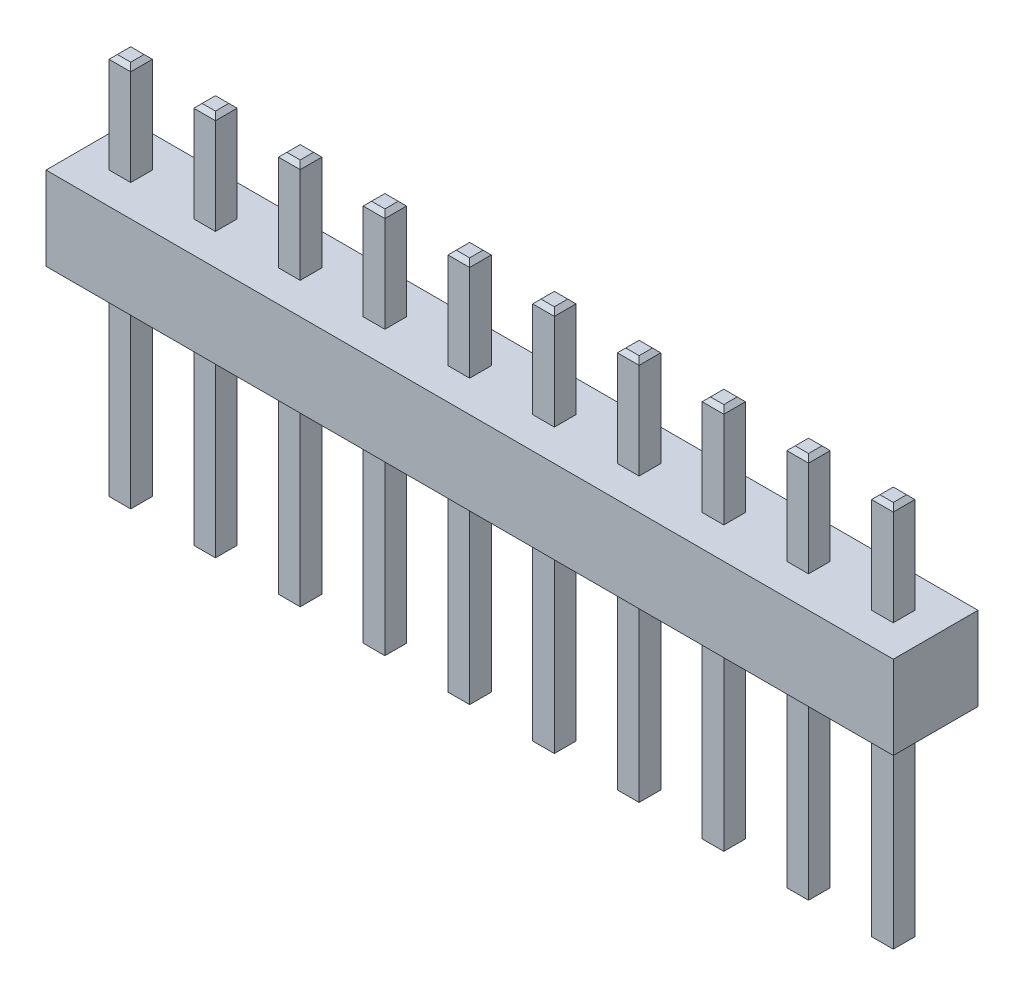
from build123d import *

# Parameters (mm, degrees)
SKETCH3_W           = 25.4
SKETCH3_H           = 2.54
BOSS_EXTRUDE1_DEPTH = 2.5
SKETCH4_W           = 0.65
SKETCH4_H           = 0.65
BOSS_EXTRUDE2_DEPTH = 3
SKETCH5_W           = 0.65
SKETCH5_H           = 0.65
BOSS_EXTRUDE3_DEPTH = 6.1
CHAMFER1_SIZE       = 0.125


with BuildPart() as part:
    # Sketch3 → Boss-Extrude1 (new body)
    with BuildSketch(Plane(origin=(0, 0, 0), x_dir=(1, 0, 0), z_dir=(0, 1, 0))):
        Rectangle(SKETCH3_W, SKETCH3_H)
    extrude(amount=BOSS_EXTRUDE1_DEPTH)

    # Sketch4 → Boss-Extrude2 (add)
    with BuildSketch(Plane(origin=(0, 2.5, 0), x_dir=(1, 0, 0), z_dir=(0, 1, 0))):
        with Locations((1.27, 0)):
            Rectangle(SKETCH4_W, SKETCH4_H)
        with Locations((3.81, 0)):
            Rectangle(SKETCH4_W, SKETCH4_H)
        with Locations((6.35, 0)):
            Rectangle(SKETCH4_W, SKETCH4_H)
        with Locations((8.89, 0)):
            Rectangle(SKETCH4_W, SKETCH4_H)
        with Locations((11.43, 0)):
            Rectangle(SKETCH4_W, SKETCH4_H)
        with Locations((-3.81, 0)):
            Rectangle(SKETCH4_W, SKETCH4_H)
        with Locations((-6.35, 0)):
            Rectangle(SKETCH4_W, SKETCH4_H)
        with Locations((-1.27, 0)):
            Rectangle(SKETCH4_W, SKETCH4_H)
        with Locations((-8.89, 0)):
            Rectangle(SKETCH4_W, SKETCH4_H)
        with Locations((-11.43, 0)):
            Rectangle(SKETCH4_W, SKETCH4_H)
    extrude(amount=BOSS_EXTRUDE2_DEPTH)

    # Sketch5 → Boss-Extrude3 (add)
    with BuildSketch(Plane.XZ):
        with Locations((1.27, 0)):
            Rectangle(SKETCH5_W, SKETCH5_H)
        with Locations((3.81, 0)):
            Rectangle(SKETCH5_W, SKETCH5_H)
        with Locations((6.35, 0)):
            Rectangle(SKETCH5_W, SKETCH5_H)
        with Locations((8.89, 0)):
            Rectangle(SKETCH5_W, SKETCH5_H)
        with Locations((11.43, 0)):
            Rectangle(SKETCH5_W, SKETCH5_H)
        with Locations((-3.81, 0)):
            Rectangle(SKETCH5_W, SKETCH5_H)
        with Locations((-6.35, 0)):
            Rectangle(SKETCH5_W, SKETCH5_H)
        with Locations((-1.27, 0)):
            Rectangle(SKETCH5_W, SKETCH5_H)
        with Locations((-8.89, 0)):
            Rectangle(SKETCH5_W, SKETCH5_H)
        with Locations((-11.43, 0)):
            Rectangle(SKETCH5_W, SKETCH5_H)
    extrude(amount=BOSS_EXTRUDE3_DEPTH)

    # Chamfer1
    chamfer1_edges = [part.edges().sort_by_distance(p)[0] for p in [
        (-8.565, 5.5, 0),
        (-8.89, 5.5, -0.325),
        (-9.215, 5.5, 0),
        (-8.89, 5.5, 0.325),
        (-11.105, 5.5, 0),
        (-11.43, 5.5, -0.325),
        (-11.755, 5.5, 0),
        (-11.43, 5.5, 0.325),
        (1.595, -6.1, 0),
        (1.27, -6.1, 0.325),
        (0.945, -6.1, 0),
        (1.27, -6.1, -0.325),
        (4.135, -6.1, 0),
        (3.81, -6.1, 0.325),
        (3.485, -6.1, 0),
        (3.81, -6.1, -0.325),
        (6.675, -6.1, 0),
        (6.35, -6.1, 0.325),
        (6.025, -6.1, 0),
        (6.35, -6.1, -0.325),
        (9.215, -6.1, 0),
        (8.89, -6.1, 0.325),
        (8.565, -6.1, 0),
        (8.89, -6.1, -0.325),
        (1.595, 5.5, 0),
        (1.27, 5.5, -0.325),
        (0.945, 5.5, 0),
        (11.755, -6.1, 0),
        (11.43, -6.1, 0.325),
        (11.105, -6.1, 0),
        (11.43, -6.1, -0.325),
        (1.27, 5.5, 0.325),
        (-3.485, -6.1, 0),
        (-3.81, -6.1, 0.325),
        (-4.135, -6.1, 0),
        (-3.81, -6.1, -0.325),
        (-0.945, -6.1, 0),
        (-1.27, -6.1, 0.325),
        (-1.595, -6.1, 0),
        (-1.27, -6.1, -0.325),
        (-6.025, -6.1, 0),
        (-6.35, -6.1, 0.325),
        (-6.675, -6.1, 0),
        (-6.35, -6.1, -0.325),
        (-8.565, -6.1, 0),
        (-8.89, -6.1, 0.325),
        (-9.215, -6.1, 0),
        (-8.89, -6.1, -0.325),
        (-11.105, -6.1, 0),
        (-11.43, -6.1, 0.325),
        (-11.755, -6.1, 0),
        (-11.43, -6.1, -0.325),
        (-3.485, 5.5, 0),
        (-3.81, 5.5, -0.325),
        (-4.135, 5.5, 0),
        (-3.81, 5.5, 0.325),
        (4.135, 5.5, 0),
        (3.81, 5.5, -0.325),
        (3.485, 5.5, 0),
        (3.81, 5.5, 0.325),
        (6.675, 5.5, 0),
        (6.35, 5.5, -0.325),
        (6.025, 5.5, 0),
        (6.35, 5.5, 0.325),
        (9.215, 5.5, 0),
        (8.89, 5.5, -0.325),
        (8.565, 5.5, 0),
        (8.89, 5.5, 0.325),
        (11.755, 5.5, 0),
        (11.43, 5.5, -0.325),
        (11.105, 5.5, 0),
        (11.43, 5.5, 0.325),
        (-0.945, 5.5, 0),
        (-1.27, 5.5, -0.325),
        (-1.595, 5.5, 0),
        (-1.27, 5.5, 0.325),
        (-6.025, 5.5, 0),
        (-6.35, 5.5, -0.325),
        (-6.675, 5.5, 0),
        (-6.35, 5.5, 0.325),
    ]]
    chamfer(chamfer1_edges, length=CHAMFER1_SIZE)


solid = part.part
